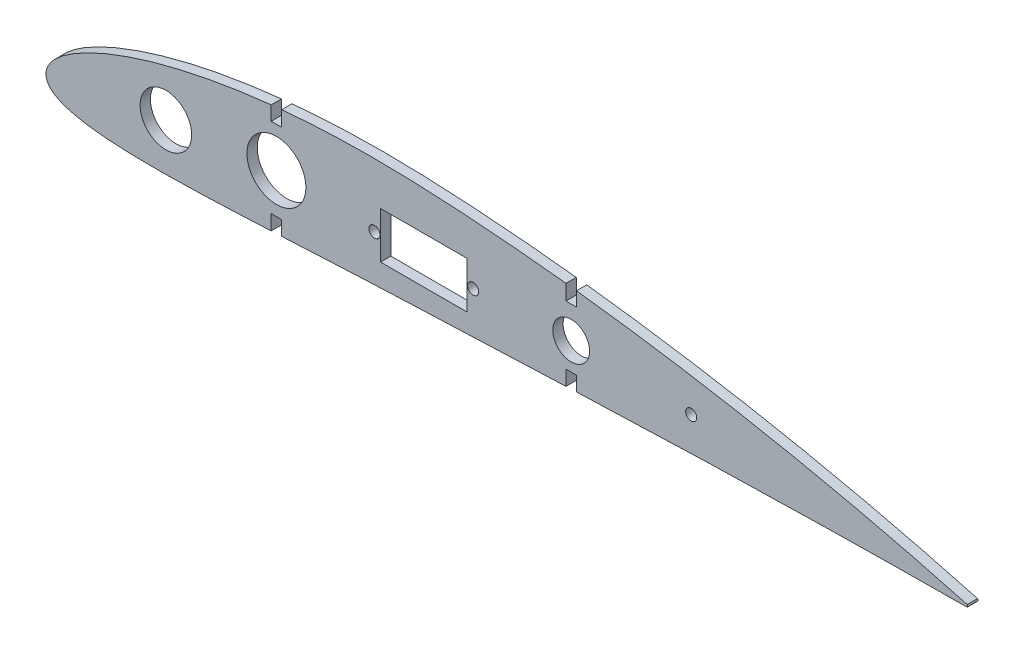
from build123d import *

# Parameters (mm, degrees)
SKETCH_1_R      = 8
SKETCH_1_R_2    = 5
SKETCH_1_R_3    = 7
SKETCH_1_R_4    = 1.5
SKETCH_1_W      = 23.5
SKETCH_1_H      = 12.6
EXTRUDE_1_DEPTH = 1.4


with BuildPart() as part:
    # Эскиз1 → Бобышка-Вытянуть1 (new, symmetric)
    with BuildSketch(Plane.XY):
        with BuildLine():
            Line((61.107619318, 19.450139662), (63.957619318, 19.450139662))
            Line((63.957619318, 19.450139662), (63.957619318, 23.588464287))
            add(Edge.make_bspline(
                [(141.107619318, 21.360787161), (140.647203073, 21.412583326), (138.008124909, 21.706530989), (133.19183673, 22.212004255), (126.658683026, 22.825721434), (120.136770918, 23.363973271), (113.62856714, 23.824677329), (107.152732037, 24.200242598), (100.741095693, 24.498399513), (94.411752715, 24.686649771), (88.155917993, 24.740095652), (81.949043055, 24.658849145), (75.780520591, 24.441013809), (69.785413798, 24.089605746), (65.850842722, 23.766532071), (63.957619318, 23.588464287)],
                knots=[0.429723551, 0.429723551, 0.429723551, 0.429723551, 0.435103874, 0.460559416, 0.485959195, 0.51130307, 0.536551515, 0.561723366, 0.586628867, 0.611085431, 0.6352512, 0.659272176, 0.683163753, 0.706922144, 0.729003809, 0.729003809, 0.729003809, 0.729003809], degree=3))
            Line((141.107619318, 21.360787161), (141.107619318, 17.19883932))
            Line((141.107619318, 17.19883932), (143.957619318, 17.19883932))
            Line((143.957619318, 17.19883932), (143.957619318, 21.033629847))
            add(Edge.make_bspline(
                [(250, 0.315), (249.15566774, 0.545019818), (246.720175698, 1.208516243), (242.391332083, 2.358339053), (236.849761204, 3.787625364), (230.779918279, 5.298008837), (224.455917947, 6.812866028), (218.030543496, 8.291610632), (211.562405045, 9.719735057), (205.072411509, 11.092374932), (198.567970913, 12.407850726), (192.052369914, 13.665297924), (185.527619973, 14.864093303), (178.995338991, 16.003404779), (172.457064741, 17.082388115), (165.914317095, 18.099827841), (159.368680729, 19.054501815), (152.821805128, 19.944885603), (147.683892721, 20.591912914), (144.728786809, 20.943344409), (143.957619318, 21.033629847)],
                knots=[0, 0, 0, 0, 0.0101622, 0.029313053, 0.052011605, 0.076619468, 0.101948061, 0.127526132, 0.153184131, 0.178867888, 0.204557903, 0.230245712, 0.255925967, 0.281594302, 0.30724642, 0.332878042, 0.358484538, 0.384061186, 0.409602822, 0.418619192, 0.418619192, 0.418619192, 0.418619192], degree=3))
            ThreePointArc((250, 0.315), (250.130477272, 0), (250, -0.315))
            add(Edge.make_bspline(
                [(143.957619318, -2.751209627), (145.13020609, -2.705557458), (148.596084852, -2.571725453), (154.352602411, -2.355626415), (161.225044134, -2.109369921), (168.090869746, -1.876634074), (174.951578522, -1.658643104), (181.808595966, -1.456378123), (188.663234462, -1.270383377), (195.516645168, -1.101112884), (202.369532894, -0.948617189), (211.49919029, -0.767742353), (220.603098666, -0.619939742), (229.617630172, -0.50292618), (236.087353854, -0.431514192), (241.980776913, -0.376520461), (246.558970011, -0.339535886), (249.120490965, -0.321271242), (250, -0.315)],
                knots=[0.581490104, 0.581490104, 0.581490104, 0.581490104, 0.595379569, 0.622543445, 0.64967326, 0.676775201, 0.703855228, 0.730918775, 0.757971338, 0.785017763, 0.812061651, 0.839103366, 0.893099152, 0.919831065, 0.945809917, 0.969680601, 0.989589706, 1, 1, 1, 1], degree=3))
            Line((143.957619318, -2.751209627), (143.957619318, 1.193130543))
            Line((143.957619318, 1.193130543), (141.107619318, 1.193130543))
            Line((141.107619318, 1.193130543), (141.107619318, -2.86287629))
            add(Edge.make_bspline(
                [(63.957619318, -6.186566126), (64.317823095, -6.168514758), (66.969747676, -6.035316313), (71.910772709, -5.784005174), (78.771375576, -5.439680449), (85.610498609, -5.110951246), (92.432107589, -4.804953317), (99.25503119, -4.531981644), (106.097378404, -4.278274658), (112.96921168, -4.00308991), (119.864404254, -3.723176166), (126.773860473, -3.440067276), (133.855552455, -3.151608468), (138.633361552, -2.960411351), (141.107619318, -2.86287629)],
                knots=[0.265564796, 0.265564796, 0.265564796, 0.265564796, 0.269833583, 0.296993022, 0.324123272, 0.351139107, 0.378035509, 0.404946016, 0.431960837, 0.459078395, 0.4863474, 0.51364083, 0.540928595, 0.570237104, 0.570237104, 0.570237104, 0.570237104], degree=3))
            Line((63.957619318, -6.186566126), (63.957619318, -2.257745247))
            Line((63.957619318, -2.257745247), (61.107619318, -2.257745247))
            Line((61.107619318, -2.257745247), (61.107619318, -6.32836923))
            add(Edge.make_bspline(
                [(0.047975, 0.621425001), (0.02271382, 0.373490086), (-0.027820789, -0.122499974), (0.077991212, -0.884434589), (0.34969565, -1.63883807), (0.814331135, -2.365068923), (1.46348078, -3.039275244), (2.290973016, -3.660999469), (3.30592875, -4.23577962), (4.535255619, -4.773674143), (6.029745688, -5.282192164), (7.868981215, -5.765316676), (10.168831391, -6.221716592), (13.075438188, -6.63961873), (16.728115362, -6.992956737), (21.189952096, -7.247345144), (26.399984415, -7.376638848), (32.197398564, -7.376256913), (38.397806759, -7.261436579), (44.857621768, -7.056641358), (51.486543096, -6.786453532), (56.920566709, -6.533358441), (60.139839208, -6.376114839), (61.107619318, -6.32836923)],
                knots=[0, 0, 0, 0, 0.002941446, 0.005884319, 0.00901613, 0.012364547, 0.016007934, 0.020036845, 0.024573728, 0.029783835, 0.03589701, 0.04324044, 0.052275965, 0.063634589, 0.077983176, 0.095698161, 0.116520086, 0.13966073, 0.16431217, 0.18991889, 0.216157201, 0.242837762, 0.254306514, 0.254306514, 0.254306514, 0.254306514], degree=3))
            add(Edge.make_bspline(
                [(61.107619318, 23.303137173), (59.917945614, 23.176751945), (56.739740439, 22.81448979), (51.605762688, 22.119065522), (45.744400311, 21.156564432), (39.995857594, 20.03537139), (34.397919842, 18.756316235), (29.010382103, 17.327615608), (23.925798408, 15.771864922), (19.27067884, 14.134269435), (15.179098391, 12.483335438), (11.74047579, 10.895610996), (8.959371869, 9.429577366), (6.76089118, 8.1086032), (5.033709748, 6.924638056), (3.671694933, 5.854229665), (2.592101123, 4.871305369), (1.738175668, 3.952595744), (1.06987083, 3.080946374), (0.57164541, 2.241622103), (0.215773899, 1.430785398), (0.102255581, 0.883241695), (0.047975, 0.621425001)],
                knots=[0.740090669, 0.740090669, 0.740090669, 0.740090669, 0.7539832, 0.77723469, 0.800246382, 0.822950709, 0.845237155, 0.866915896, 0.887662335, 0.906968281, 0.924203157, 0.938878975, 0.950931611, 0.960693484, 0.968646729, 0.975232933, 0.980794744, 0.985583761, 0.989781539, 0.993521313, 0.996902113, 1, 1, 1, 1], degree=3))
            Line((61.107619318, 23.303137173), (61.107619318, 19.450139662))
        make_face()
        with Locations((62.532619318, 8.596197208)):
            Circle(SKETCH_1_R, mode=Mode.SUBTRACT)
        with Locations((142.532619318, 8.596197208)):
            Circle(SKETCH_1_R_2, mode=Mode.SUBTRACT)
        with Locations((32.532619318, 5.448144701)):
            Circle(SKETCH_1_R_3, mode=Mode.SUBTRACT)
        with Locations((175.091334091, 7.493910357)):
            Circle(SKETCH_1_R_4, mode=Mode.SUBTRACT)
        with Locations((115.917619318, 7.493910357)):
            Circle(SKETCH_1_R_4, mode=Mode.SUBTRACT)
        with Locations((89.147619318, 7.493910357)):
            Circle(SKETCH_1_R_4, mode=Mode.SUBTRACT)
        with Locations((102.532619318, 7.493910357)):
            Rectangle(SKETCH_1_W, SKETCH_1_H, mode=Mode.SUBTRACT)
    extrude(amount=EXTRUDE_1_DEPTH, both=True)


solid = part.part
